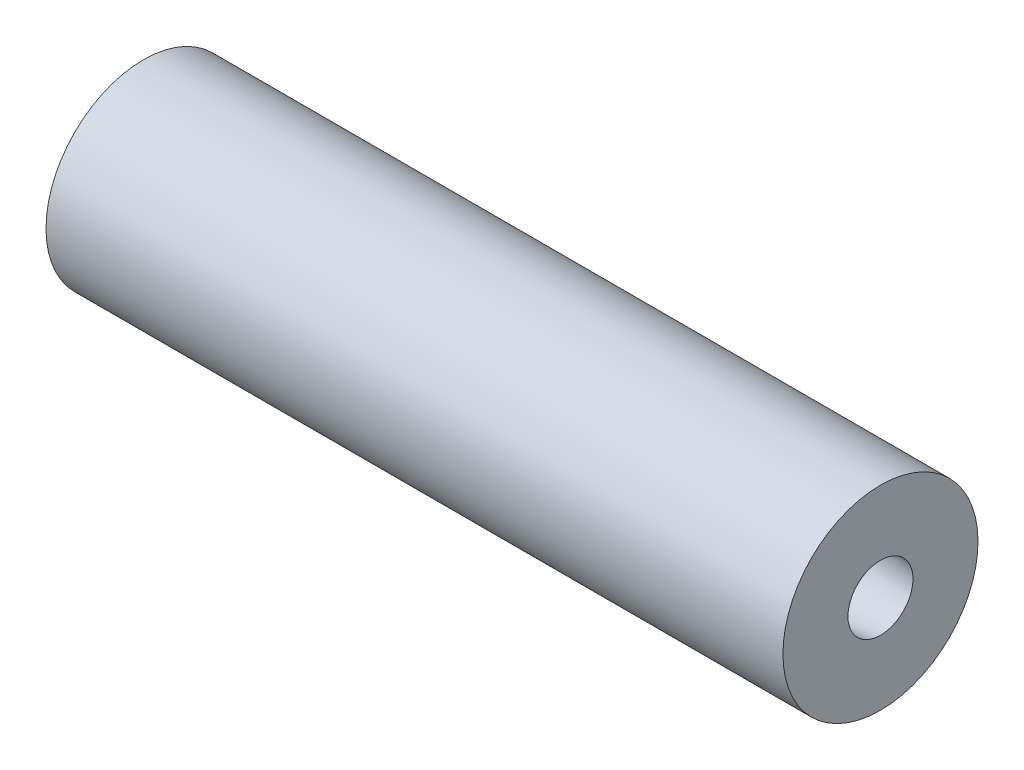
from build123d import *


with BuildPart() as part:
    # Эскиз1 → Повернуть1 (revolve)
    with BuildSketch(Plane.XY, mode=Mode.PRIVATE) as revolve_1_sk:
        Polygon((0, 9), (68, 9), (68, 3), (0, 8), align=None)
    revolve(revolve_1_sk.sketch.rotate(Axis((0, 0, 0), (1, 0, 0)), 90), axis=Axis((0, 0, 0), (1, 0, 0)))


solid = part.part
